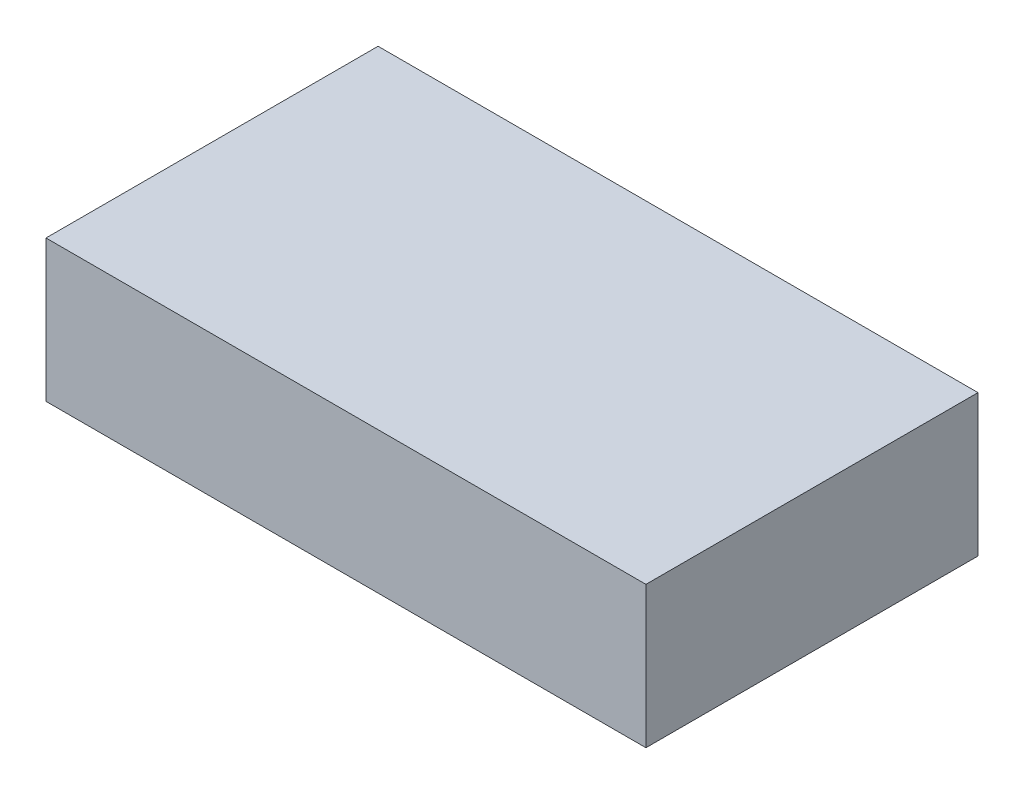
from build123d import *

# Parameters (mm, degrees)
SKETCH_1_W      = 76.6
SKETCH_1_H      = 42.4
EXTRUDE_1_DEPTH = 18.07


with BuildPart() as part:
    # Эскиз1 → Бобышка-Вытянуть1 (new body)
    with BuildSketch(Plane(origin=(0, 0, 0), x_dir=(1, 0, 0), z_dir=(0, 1, 0))):
        Rectangle(SKETCH_1_W, SKETCH_1_H)
    extrude(amount=EXTRUDE_1_DEPTH)


solid = part.part
